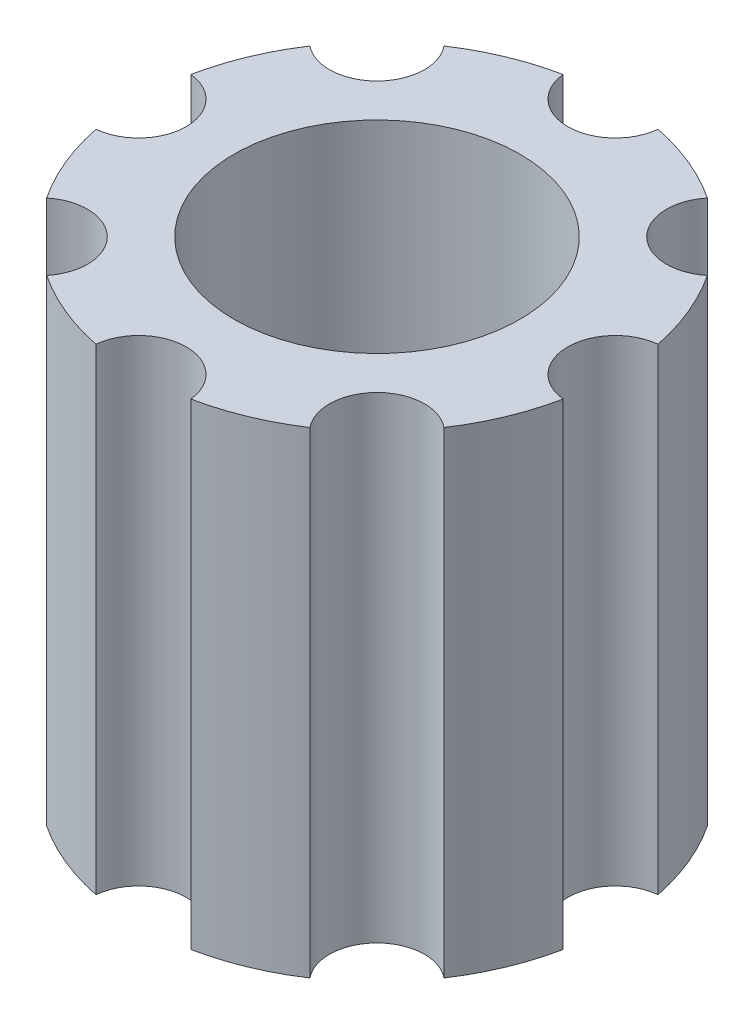
from build123d import *

# Parameters (mm, degrees)
BOSS_EXTRUDE1_DEPTH = 5


with BuildPart() as part:
    # Sketch1 → Boss-Extrude1 (new body)
    with BuildSketch(Plane(origin=(0, 0, 0), x_dir=(1, 0, 0), z_dir=(0, 1, 0))):
        with BuildLine():
            Line((-1.5, 0), (-2, 0))
            ThreePointArc((-2, 0), (-2.129190076, -0.335410197), (-2.45, -0.497493719))
            ThreePointArc((-2.45, -0.497493719), (-2.309698831, -0.956708581), (-2.084192796, -1.380630432))
            ThreePointArc((-2.084192796, -1.380630432), (-1.414213562, -1.414213562), (-1.380630432, -2.084192796))
            ThreePointArc((-1.380630432, -2.084192796), (-0.956708581, -2.309698831), (-0.497493719, -2.45))
            ThreePointArc((-0.497493719, -2.45), (0, -2), (0.497493719, -2.45))
            ThreePointArc((0.497493719, -2.45), (0.956708581, -2.309698831), (1.380630432, -2.084192796))
            ThreePointArc((1.380630432, -2.084192796), (1.414213562, -1.414213562), (2.084192796, -1.380630432))
            ThreePointArc((2.084192796, -1.380630432), (2.309698831, -0.956708581), (2.45, -0.497493719))
            ThreePointArc((2.45, -0.497493719), (2.129190076, -0.335410197), (2, 0))
            Line((2, 0), (1.5, 0))
            ThreePointArc((1.5, 0), (0, -1.5), (-1.5, 0))
        make_face()
        with BuildLine():
            ThreePointArc((-2.45, 0.497493719), (-2.129190076, 0.335410197), (-2, 0))
            Line((-2, 0), (-1.5, 0))
            ThreePointArc((-1.5, 0), (0, 1.5), (1.5, 0))
            Line((1.5, 0), (2, 0))
            ThreePointArc((2, 0), (2.129190076, 0.335410197), (2.45, 0.497493719))
            ThreePointArc((2.45, 0.497493719), (2.309698831, 0.956708581), (2.084192796, 1.380630432))
            ThreePointArc((2.084192796, 1.380630432), (1.414213562, 1.414213562), (1.380630432, 2.084192796))
            ThreePointArc((1.380630432, 2.084192796), (0.956708581, 2.309698831), (0.497493719, 2.45))
            ThreePointArc((0.497493719, 2.45), (0, 2), (-0.497493719, 2.45))
            ThreePointArc((-0.497493719, 2.45), (-0.956708581, 2.309698831), (-1.380630432, 2.084192796))
            ThreePointArc((-1.380630432, 2.084192796), (-1.414213562, 1.414213562), (-2.084192796, 1.380630432))
            ThreePointArc((-2.084192796, 1.380630432), (-2.309698831, 0.956708581), (-2.45, 0.497493719))
        make_face()
    extrude(amount=BOSS_EXTRUDE1_DEPTH)


solid = part.part
